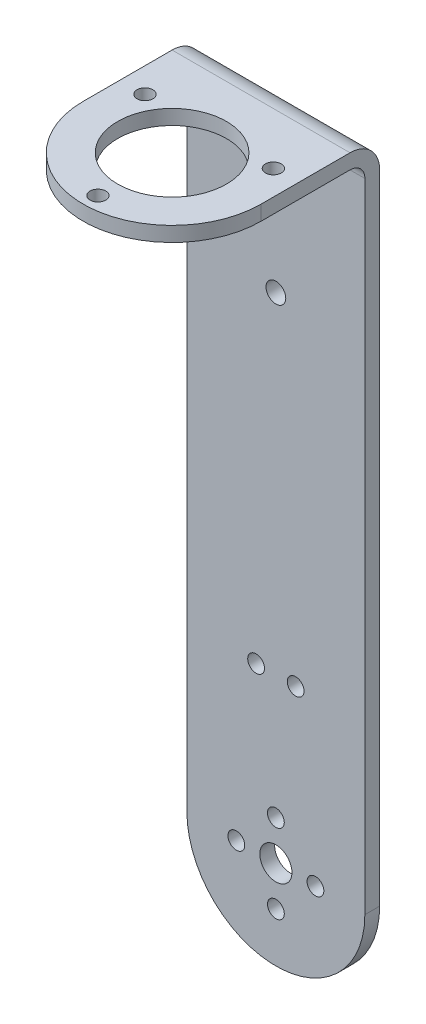
from build123d import *

# Parameters (mm, degrees)
SKETCH_1_R                                 = 3.25
SKETCH_1_R_2                               = 1.7
SKETCH_1_R_3                               = 2
F_01_MAIN_PLATE_135_W36_T3_EST_HOLES_DEPTH = 3
SKETCH_2_R                                 = 11
SKETCH_2_R_2                               = 1.6
F_02_FLANGE_H42_HOLE22_EST_DEPTH           = 3
F_03_BEND_INNER_R3_EST_R                   = 3
F_04_BEND_OUTER_R6_EST_R                   = 6


with BuildPart() as part:
    # 草图1 → 01_Main_plate_135_W36_T3_EST_holes (new body)
    with BuildSketch(Plane.XY):
        with BuildLine():
            Line((-18, 0), (-18, 135))
            Line((-18, 135), (18, 135))
            Line((18, 135), (18, 0))
            ThreePointArc((18, 0), (0, -18), (-18, 0))
        make_face()
        Circle(SKETCH_1_R, mode=Mode.SUBTRACT)
        with Locations((-8, 0)):
            Circle(SKETCH_1_R_2, mode=Mode.SUBTRACT)
        with Locations((8, 0)):
            Circle(SKETCH_1_R_2, mode=Mode.SUBTRACT)
        with Locations((0, -8)):
            Circle(SKETCH_1_R_2, mode=Mode.SUBTRACT)
        with Locations((0, 8)):
            Circle(SKETCH_1_R_2, mode=Mode.SUBTRACT)
        with Locations((-4, 33)):
            Circle(SKETCH_1_R_2, mode=Mode.SUBTRACT)
        with Locations((4, 33)):
            Circle(SKETCH_1_R_2, mode=Mode.SUBTRACT)
        with Locations((0, 100)):
            Circle(SKETCH_1_R_3, mode=Mode.SUBTRACT)
    extrude(amount=F_01_MAIN_PLATE_135_W36_T3_EST_HOLES_DEPTH)

    # 草图2 → 02_Flange_H42_hole22_EST (add)
    with BuildSketch(Plane(origin=(0, 135, 0), x_dir=(1, 0, 0), z_dir=(0, 1, 0))):
        with BuildLine():
            Line((-18, 0), (18, 0))
            Line((18, 0), (18, -24))
            ThreePointArc((18, -24), (0, -42), (-18, -24))
            Line((-18, -24), (-18, 0))
        make_face()
        with Locations(Location((0, -24, 0), (0, 0, 270))):
            Circle(SKETCH_2_R, mode=Mode.SUBTRACT)
        with Locations(Location((0, -39, 0), (0, 0, 270))):
            Circle(SKETCH_2_R_2, mode=Mode.SUBTRACT)
        with Locations(Location((-12.990381, -16.5, 0), (0, 0, 270))):
            Circle(SKETCH_2_R_2, mode=Mode.SUBTRACT)
        with Locations(Location((12.990381, -16.5, 0), (0, 0, 270))):
            Circle(SKETCH_2_R_2, mode=Mode.SUBTRACT)
    extrude(amount=-F_02_FLANGE_H42_HOLE22_EST_DEPTH)

    # 03_Bend_inner_R3_EST
    f_03_bend_inner_r3_est_edges = [part.edges().sort_by_distance(p)[0] for p in [
        (0, 132, 3),
    ]]
    fillet(f_03_bend_inner_r3_est_edges, radius=F_03_BEND_INNER_R3_EST_R)

    # 04_Bend_outer_R6_EST
    f_04_bend_outer_r6_est_edges = [part.edges().sort_by_distance(p)[0] for p in [
        (0, 135, 0),
    ]]
    fillet(f_04_bend_outer_r6_est_edges, radius=F_04_BEND_OUTER_R6_EST_R)


solid = part.part
